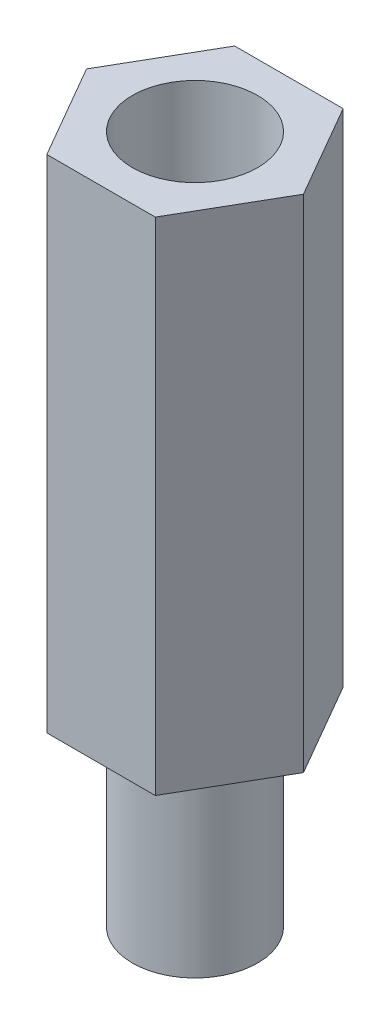
from build123d import *

# Parameters (mm, degrees)
SKETCH_2_R      = 2
EXTRUDE_1_DEPTH = 16
SKETCH_2_2_R    = 2
EXTRUDE_2_DEPTH = 6


with BuildPart() as part:
    # 草图2 → 凸台-拉伸1 (new body)
    with BuildSketch(Plane(origin=(0, 0, 0), x_dir=(1, 0, 0), z_dir=(0, 1, 0))):
        Polygon((3.464101615, 0), (1.732050808, 3), (-1.732050808, 3), (-3.464101615, 0), (-1.732050808, -3), (1.732050808, -3), align=None)
        Circle(SKETCH_2_R, mode=Mode.SUBTRACT)
    extrude(amount=EXTRUDE_1_DEPTH)


with BuildPart() as body_2:
    # 草图2<2> → 凸台-拉伸2 (new body)
    with BuildSketch(Plane(origin=(0, 0, 0), x_dir=(1, 0, 0), z_dir=(0, 1, 0))):
        Circle(SKETCH_2_2_R)
    extrude(amount=-EXTRUDE_2_DEPTH)


solid = Compound([part.part, body_2.part])
